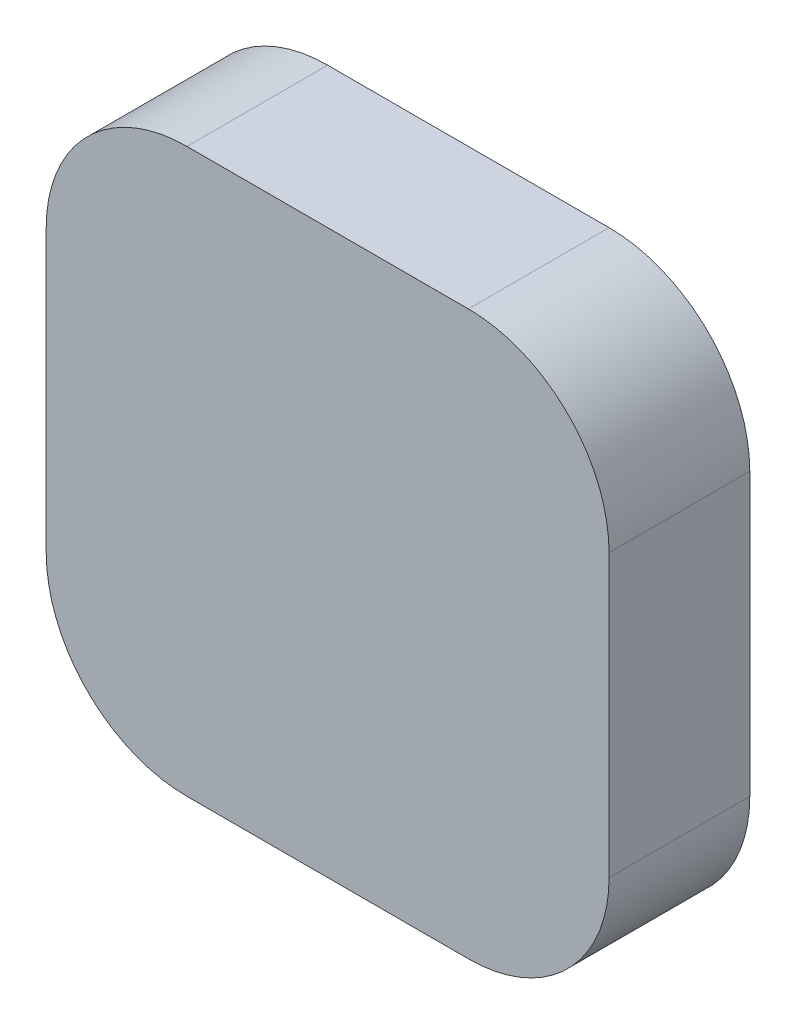
from build123d import *

# Parameters (mm, degrees)
SKETCH1_W           = 20
SKETCH1_H           = 20
BOSS_EXTRUDE1_DEPTH = 5
FILLET1_R           = 5


with BuildPart() as part:
    # Sketch1 → Boss-Extrude1 (new body)
    with BuildSketch(Plane.XY):
        with Locations((10, 10)):
            Rectangle(SKETCH1_W, SKETCH1_H)
    extrude(amount=BOSS_EXTRUDE1_DEPTH)

    # Fillet1
    fillet1_edges = [part.edges().sort_by_distance(p)[0] for p in [
        (0, 20, 2.5),
        (20, 20, 2.5),
        (20, 0, 2.5),
        (0, 0, 2.5),
    ]]
    fillet(fillet1_edges, radius=FILLET1_R)


solid = part.part
